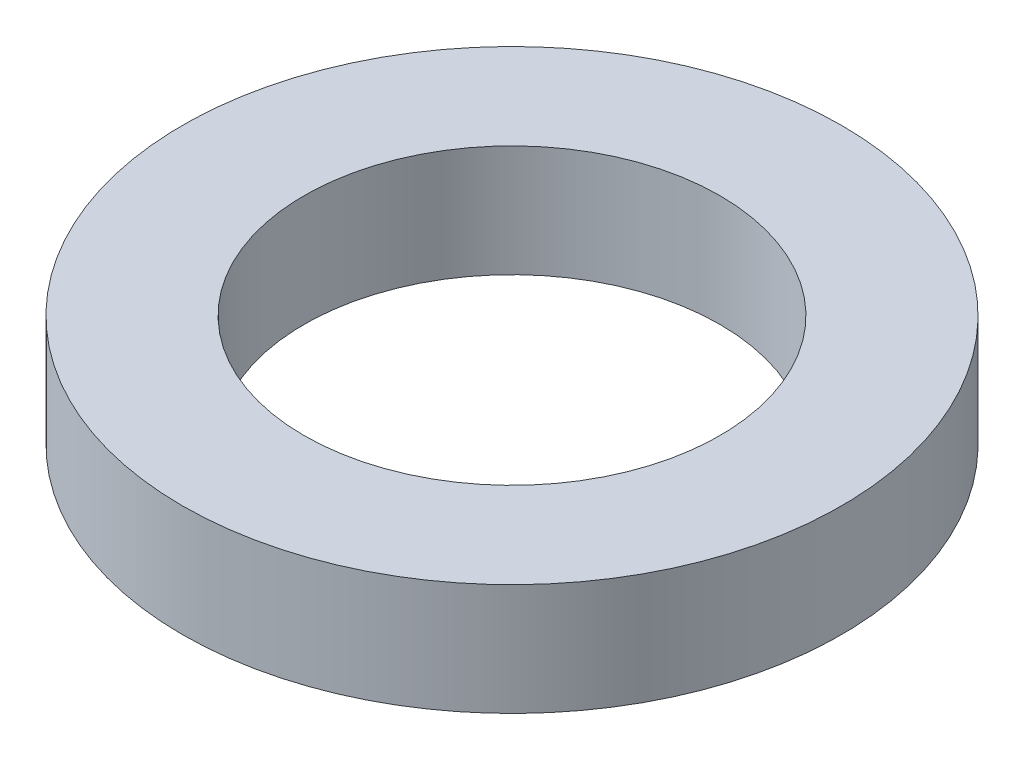
from build123d import *

# Parameters (mm, degrees)
SKETCH1_R           = 3.25
SKETCH1_R_2         = 2.05
BOSS_EXTRUDE1_DEPTH = 1.1


with BuildPart() as part:
    # Sketch1 → Boss-Extrude1 (new body)
    with BuildSketch(Plane(origin=(0, 0, 0), x_dir=(1, 0, 0), z_dir=(0, 1, 0))):
        with Locations(Location((0, 0, 0), (0, 0, 270))):
            Circle(SKETCH1_R)
        with Locations(Location((0, 0, 0), (0, 0, 270))):
            Circle(SKETCH1_R_2, mode=Mode.SUBTRACT)
    extrude(amount=BOSS_EXTRUDE1_DEPTH)


solid = part.part
